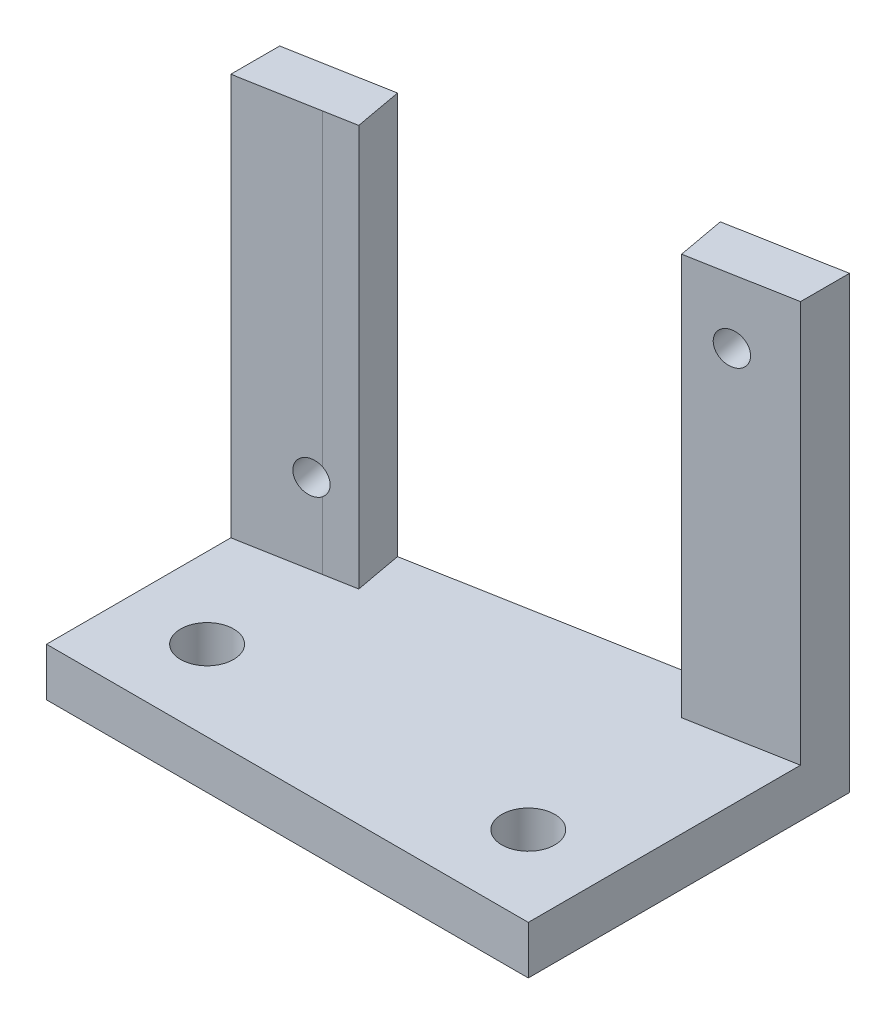
from build123d import *

# Parameters (mm, degrees)
SKETCH1_W      = 30
SKETCH1_H      = 20
SKETCH1_R      = 1.65
EXTRUDE1_DEPTH = 3
EXTRUDE2_DEPTH = 25
EXTRUDE3_DEPTH = 25
SKETCH5_R      = 1
SKETCH5_W      = 17.276120282
SKETCH5_H      = 25
EXTRUDE4_DEPTH = 25


with BuildPart() as part:
    # Sketch1 → Extrude1 (new body)
    with BuildSketch(Plane(origin=(0, 0, 0), x_dir=(1, 0, 0), z_dir=(0, 1, 0))):
        with Locations((0, 5)):
            Rectangle(SKETCH1_W, SKETCH1_H)
        with Locations(Location((10, 0, 0), (0, 0, 270))):
            Circle(SKETCH1_R, mode=Mode.SUBTRACT)
        with Locations(Location((-10, 0, 0), (0, 0, 270))):
            Circle(SKETCH1_R, mode=Mode.SUBTRACT)
    extrude(amount=EXTRUDE1_DEPTH)

    # Sketch3 → Extrude2 (add)
    with BuildSketch(Plane(origin=(0, 3, 0), x_dir=(1, 0, 0), z_dir=(0, 1, 0))):
        Polygon((15, 11.950319031), (15, 15), (-15, 9.517719352), (-14.462267947, 6.575155369), (-10.171425839, 7.350425006), align=None)
        Polygon((-14.462267947, 6.575155369), (-15, 9.517719352), (-15, 6.477997906), align=None)
    extrude(amount=EXTRUDE2_DEPTH)

    # Sketch4 → Extrude3 (cut)
    with BuildSketch(Plane(origin=(0, 3, 0), x_dir=(1, 0, 0), z_dir=(0, 1, 0))):
        Polygon((-15, 9.517719352), (-15, 15), (15, 15), align=None)
    extrude(amount=-EXTRUDE3_DEPTH, mode=Mode.SUBTRACT)

    # Sketch5 → Extrude4 (cut)
    with BuildSketch(Plane(origin=(-1.628525639, 0, -8.911577554), x_dir=(0.9837094537947668, 0, -0.1797657100639655), z_dir=(0.1797657100639655, 0, 0.9837094537947668))):
        with Locations((-9.26857722, 8)):
            Circle(SKETCH5_R)
        with Locations((13.23142278, 24)):
            Circle(SKETCH5_R)
        with Locations((1.901847648, 15.5)):
            Rectangle(SKETCH5_W, SKETCH5_H)
    extrude(amount=-EXTRUDE4_DEPTH, mode=Mode.SUBTRACT)


solid = part.part
